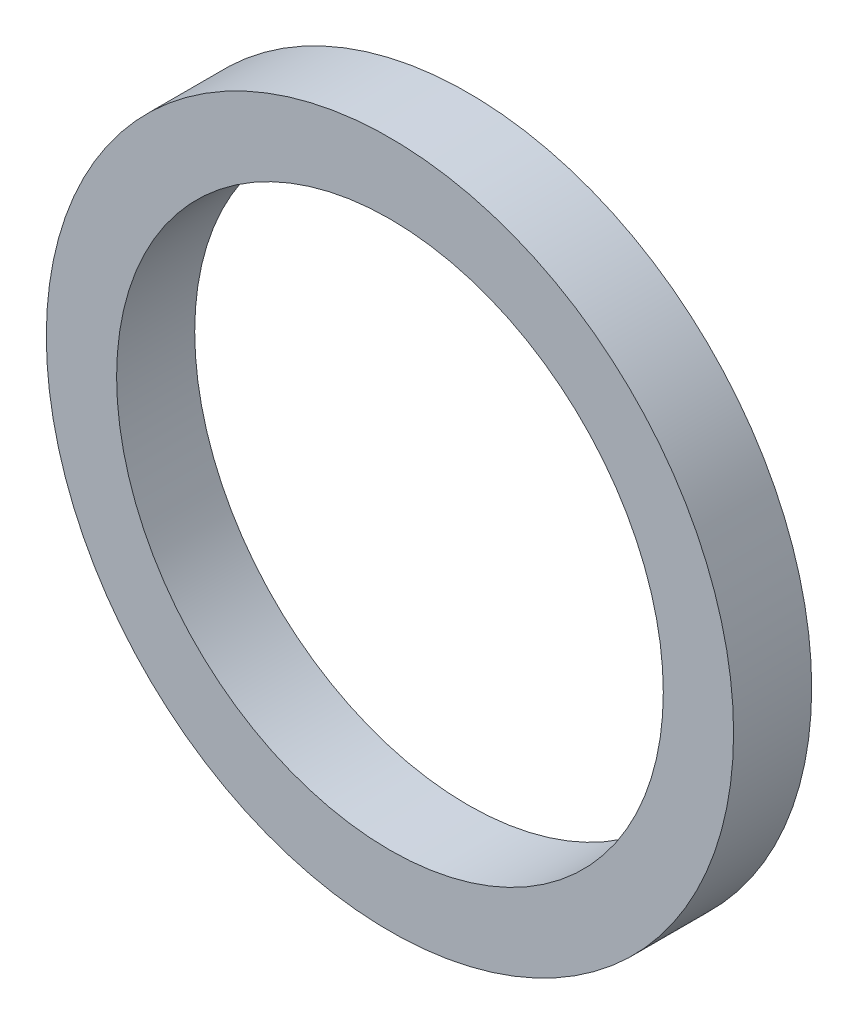
from build123d import *

# Parameters (mm, degrees)
SKETCH_1_R      = 22
SKETCH_1_R_2    = 17.5
EXTRUDE_1_DEPTH = 5


with BuildPart() as part:
    # 草图1 → 凸台-拉伸1 (new body)
    with BuildSketch(Plane.XY):
        Circle(SKETCH_1_R)
        Circle(SKETCH_1_R_2, mode=Mode.SUBTRACT)
    extrude(amount=EXTRUDE_1_DEPTH)


solid = part.part
